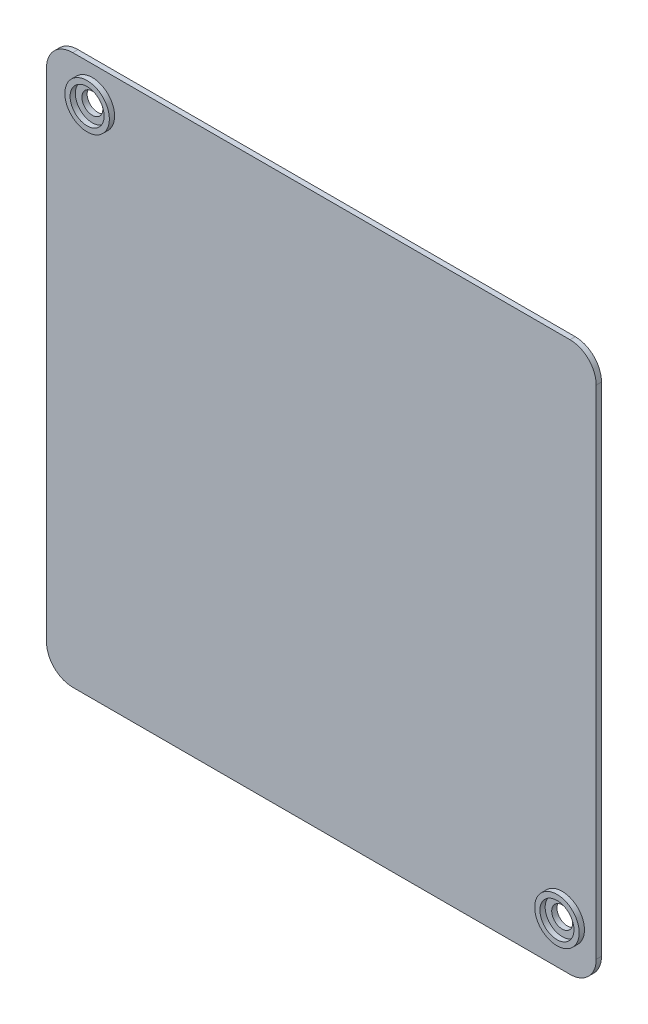
from build123d import *

# Parameters (mm, degrees)
ESQUISSE1_W        = 105
ESQUISSE1_H        = 105
ESQUISSE1_R        = 2
BOSS_EXTRU_1_DEPTH = 1
ESQUISSE1_4_R      = 4.25
ESQUISSE1_4_R_2    = 3.25
BOSS_EXTRU_3_DEPTH = 2
CONG_1_R           = 5


with BuildPart() as part:
    # Esquisse1 → Boss.-Extru.1 (new body)
    with BuildSketch(Plane.XY):
        Rectangle(ESQUISSE1_W, ESQUISSE1_H)
        with Locations((46, -43.75)):
            Circle(ESQUISSE1_R, mode=Mode.SUBTRACT)
        with Locations((-43.75, 46)):
            Circle(ESQUISSE1_R, mode=Mode.SUBTRACT)
    extrude(amount=BOSS_EXTRU_1_DEPTH)

    # Esquisse1<4> → Boss.-Extru.3 (add)
    # profile 1 of 2: a face of its own
    with BuildSketch(Plane.XY):
        with Locations((-43.75, 46)):
            Circle(ESQUISSE1_4_R)
        with Locations((-43.75, 46)):
            Circle(ESQUISSE1_4_R_2, mode=Mode.SUBTRACT)
    # profile 2 of 2: a face of its own
    with BuildSketch(Plane.XY):
        with Locations((46, -43.75)):
            Circle(ESQUISSE1_4_R)
        with Locations((46, -43.75)):
            Circle(ESQUISSE1_4_R_2, mode=Mode.SUBTRACT)
    extrude(amount=BOSS_EXTRU_3_DEPTH)

    # Congé1
    cong_1_edges = [part.edges().sort_by_distance(p)[0] for p in [
        (52.5, -52.5, 0.5),
        (-52.5, -52.5, 0.5),
        (-52.5, 52.5, 0.5),
        (52.5, 52.5, 0.5),
    ]]
    fillet(cong_1_edges, radius=CONG_1_R)


solid = part.part
